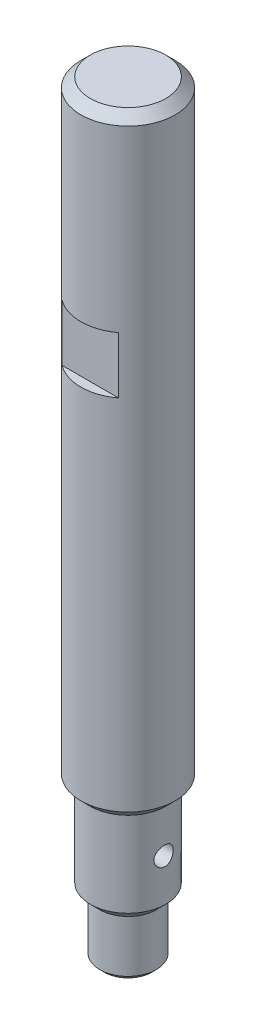
from build123d import *

# Parameters (mm, degrees)
CUT_EXTRUDE_START        = -40
SKETCH_2_OUTSIDE_W       = 54.89
SKETCH_2_OUTSIDE_H       = 54.89
SKETCH_2_OUTSIDE_W_2     = 20
SKETCH_2_OUTSIDE_H_2     = 16
CUT_EXTRUDE_1_DEPTH      = 12
CUT_EXTRUDE_2_DEPTH      = 196.51214796
CUT_EXTRUDE_2_DEPTH_BACK = 196.51214796
SKETCH_3_R               = 2


with BuildPart() as part:
    # Эскиз1 → Повернуть1 (revolve)
    with BuildSketch(Plane.XY, mode=Mode.PRIVATE) as revolve_1_sk:
        Polygon((-6, 1), (-5, 0), (0, 0), (0, 162), (-8, 162), (-10, 160), (-10, 34), (-8, 32), (-8, 14), (-6, 12), align=None)
    revolve(revolve_1_sk.sketch.rotate(Axis((0, 0, 0), (0, 1, 0)), 270), axis=Axis((0, 0, 0), (0, 1, 0)))

    # Эскиз2 outside → Вырез-Вытянуть1 (cut)
    with BuildSketch(Plane(origin=(0, 162, 0), x_dir=(1, 0, 0), z_dir=(0, 1, 0)).offset(CUT_EXTRUDE_START)):
        Rectangle(SKETCH_2_OUTSIDE_W, SKETCH_2_OUTSIDE_H)
        Rectangle(SKETCH_2_OUTSIDE_W_2, SKETCH_2_OUTSIDE_H_2, mode=Mode.SUBTRACT)
    extrude(amount=-CUT_EXTRUDE_1_DEPTH, mode=Mode.SUBTRACT)

    # Эскиз3 → Вырез-Вытянуть2 (cut, two sides: drawn at the far end of the back side and taken through both)
    with BuildSketch(Plane(origin=(0, -33, 0), x_dir=(0.027583216315568815, 0, -0.9996195107027916), z_dir=(0.9996195107027916, 0, 0.027583216315568815)).offset(-CUT_EXTRUDE_2_DEPTH_BACK)):
        with Locations((0, 56)):
            Circle(SKETCH_3_R)
    extrude(amount=CUT_EXTRUDE_2_DEPTH + CUT_EXTRUDE_2_DEPTH_BACK, mode=Mode.SUBTRACT)


solid = part.part
